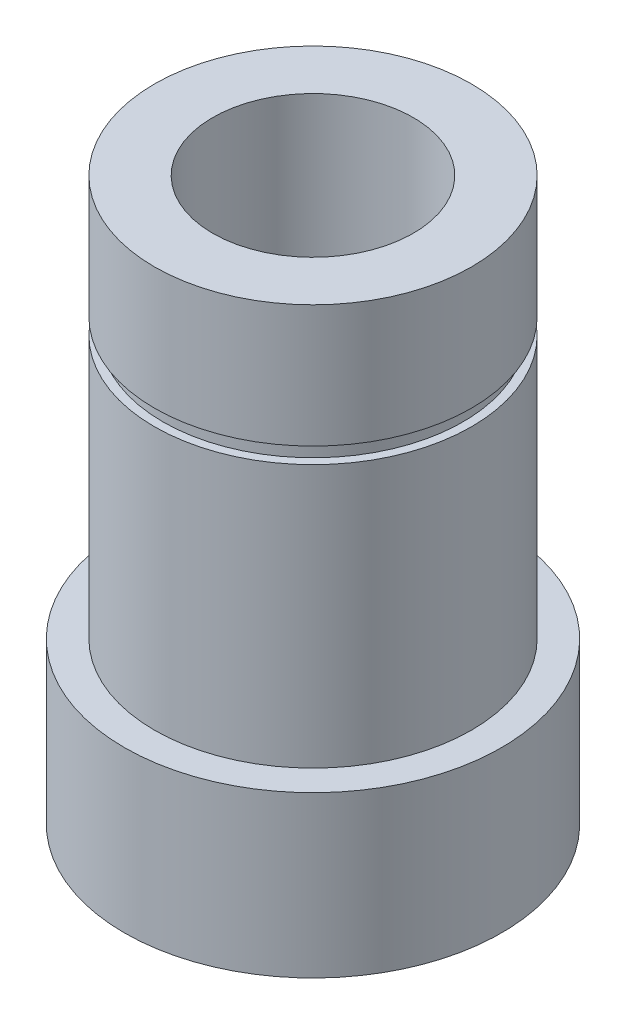
from build123d import *

# Parameters (mm, degrees)
SKETCH1_R                = 4.7
BOSS_EXTRUDE1_DEPTH      = 4
SKETCH2_R                = 3.95
BOSS_EXTRUDE2_DEPTH      = 6.5
SKETCH3_R                = 3.95
BOSS_EXTRUDE3_DEPTH      = 1
SKETCH4_R                = 3.95
BOSS_EXTRUDE4_DEPTH      = 2.5
SKETCH5_R                = 2.5
CUT_EXTRUDE1_DEPTH       = 16.497741771
CUT_EXTRUDE_1_DEPTH      = 0.2
CUT_EXTRUDE_1_DEPTH_BACK = 0.2
SKETCH_1_OUTSIDE_W       = 15.262
SKETCH_1_OUTSIDE_H       = 15.262
SKETCH_1_OUTSIDE_R       = 3.74


with BuildPart() as part:
    # Sketch1 → Boss-Extrude1 (new body)
    with BuildSketch(Plane(origin=(0, 0, 0), x_dir=(1, 0, 0), z_dir=(0, 1, 0))):
        with Locations(Location((0, 0, 0), (0, 0, 270))):
            Circle(SKETCH1_R)
    extrude(amount=BOSS_EXTRUDE1_DEPTH)

    # Sketch2 → Boss-Extrude2 (add)
    with BuildSketch(Plane(origin=(0, 4, 0), x_dir=(1, 0, 0), z_dir=(0, 1, 0))):
        with Locations(Location((0, 0, 0), (0, 0, 90))):
            Circle(SKETCH2_R)
    extrude(amount=BOSS_EXTRUDE2_DEPTH)

    # Sketch3 → Boss-Extrude3 (add)
    with BuildSketch(Plane(origin=(0, 10.5, 0), x_dir=(1, 0, 0), z_dir=(0, 1, 0))):
        with Locations(Location((0, 0, 0), (0, 0, 90))):
            Circle(SKETCH3_R)
    extrude(amount=BOSS_EXTRUDE3_DEPTH)

    # Sketch4 → Boss-Extrude4 (add)
    with BuildSketch(Plane(origin=(0, 11.5, 0), x_dir=(1, 0, 0), z_dir=(0, 1, 0))):
        with Locations(Location((0, 0, 0), (0, 0, 90))):
            Circle(SKETCH4_R)
    extrude(amount=BOSS_EXTRUDE4_DEPTH)

    # Sketch5 → Cut-Extrude1 (cut, through all)
    with BuildSketch(Plane(origin=(0, 14, 0), x_dir=(1, 0, 0), z_dir=(0, 1, 0))):
        with Locations(Location((0, 0, 0), (0, 0, 270))):
            Circle(SKETCH5_R)
    extrude(amount=-CUT_EXTRUDE1_DEPTH, mode=Mode.SUBTRACT)

    # 草图1 outside → 切除-拉伸1 (cut, two sides: drawn at the far end of the back side and taken through both)
    with BuildSketch(Plane(origin=(0, 10.75, 0), x_dir=(1, 0, 0), z_dir=(0, 1, 0)).offset(-CUT_EXTRUDE_1_DEPTH_BACK)):
        Rectangle(SKETCH_1_OUTSIDE_W, SKETCH_1_OUTSIDE_H)
        with Locations(Location((0, 0, 0), (0, 0, 270))):
            Circle(SKETCH_1_OUTSIDE_R, mode=Mode.SUBTRACT)
    extrude(amount=CUT_EXTRUDE_1_DEPTH + CUT_EXTRUDE_1_DEPTH_BACK, mode=Mode.SUBTRACT)


solid = part.part
